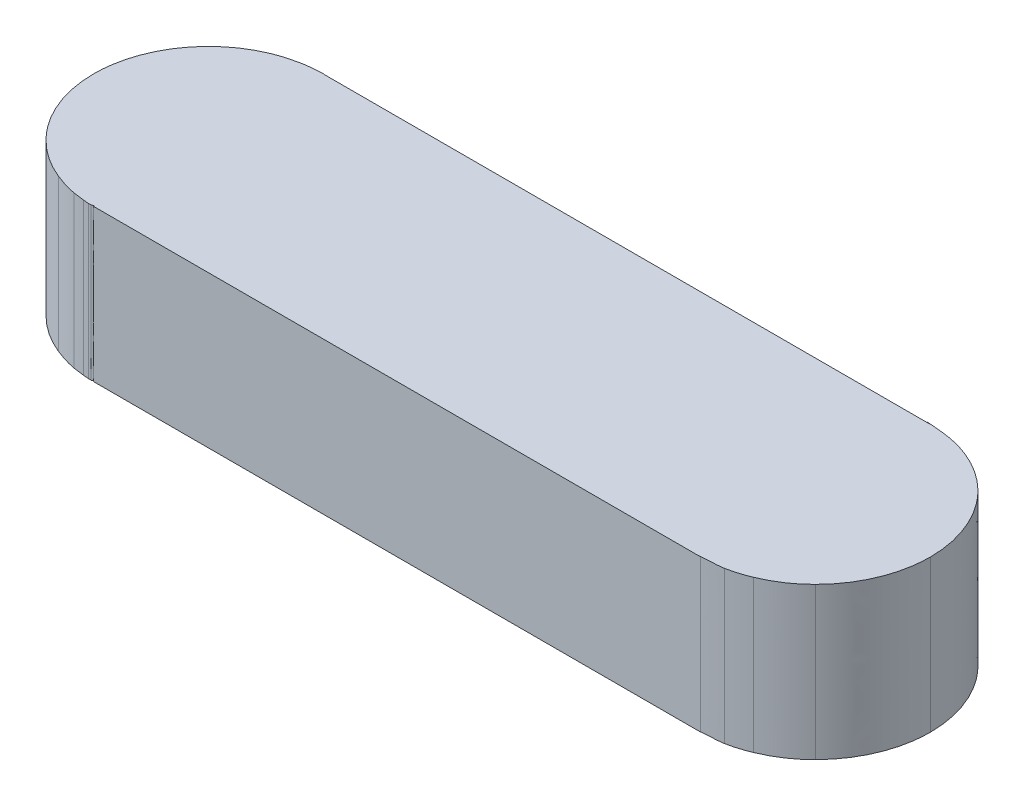
from build123d import *

# Parameters (mm, degrees)
BOSS_EXTRUDE1_DEPTH = 6.35


with BuildPart() as part:
    # Sketch1 → Boss-Extrude1 (new body)
    with BuildSketch(Plane(origin=(0, 0, 0), x_dir=(1, 0, 0), z_dir=(0, 1, 0))):
        with BuildLine():
            Line((5.0230024, 0.2204974), (30.4202338, 0.2204974))
            add(Edge.make_bspline(
                [(30.4202338, 0.2204974), (29.8139104, 0.2204974), (31.033466, 0.245491), (31.3297316, 0.3029966)],
                knots=[0, 0, 0, 0, 1, 1, 1, 1], degree=3))
            add(Edge.make_bspline(
                [(31.3297316, 0.3029966), (31.6535816, 0.364998), (31.9636394, 0.4614926), (32.259905, 0.5854954)],
                knots=[0, 0, 0, 0, 1, 1, 1, 1], degree=3))
            add(Edge.make_bspline(
                [(32.259905, 0.5854954), (32.8593704, 0.833501), (33.3623412, 1.1642344), (33.8171028, 1.6258794)],
                knots=[0, 0, 0, 0, 1, 1, 1, 1], degree=3))
            add(Edge.make_bspline(
                [(33.8171028, 1.6258794), (34.7197172, 2.5216358), (35.2295968, 3.7481002), (35.2295968, 5.0227484)],
                knots=[0, 0, 0, 0, 1, 1, 1, 1], degree=3))
            add(Edge.make_bspline(
                [(35.2295968, 5.0227484), (35.2295968, 6.2974474), (34.7197172, 7.5169776), (33.8239862, 8.4196428)],
                knots=[0, 0, 0, 0, 1, 1, 1, 1], degree=3))
            add(Edge.make_bspline(
                [(33.8239862, 8.4196428), (33.3623412, 8.874633), (32.8593704, 9.2119958), (32.259905, 9.4600522)],
                knots=[0, 0, 0, 0, 1, 1, 1, 1], degree=3))
            add(Edge.make_bspline(
                [(32.259905, 9.4600522), (31.9636648, 9.5840296), (31.6535816, 9.6735392), (31.3297316, 9.7355406)],
                knots=[0, 0, 0, 0, 1, 1, 1, 1], degree=3))
            add(Edge.make_bspline(
                [(31.3297316, 9.7355406), (31.0334406, 9.797542), (29.8207938, 9.8940366), (30.4202338, 9.8250502)],
                knots=[0, 0, 0, 0, 1, 1, 1, 1], degree=3))
            Line((30.4202338, 9.8250502), (5.0230024, 9.8240342))
            add(Edge.make_bspline(
                [(5.0230024, 9.8240342), (5.091938, 9.8440494), (4.9471326, 9.8240342), (4.912741, 9.8240342)],
                knots=[0, 0, 0, 0, 1, 1, 1, 1], degree=3))
            add(Edge.make_bspline(
                [(4.912741, 9.8240342), (4.8782478, 9.8240342), (4.8368966, 9.8190304), (4.802505, 9.8190304)],
                knots=[0, 0, 0, 0, 1, 1, 1, 1], degree=3))
            add(Edge.make_bspline(
                [(4.802505, 9.8190304), (4.7266352, 9.8190304), (4.650994, 9.814052), (4.5750988, 9.8040444)],
                knots=[0, 0, 0, 0, 1, 1, 1, 1], degree=3))
            add(Edge.make_bspline(
                [(4.5750988, 9.8040444), (4.4167044, 9.789033), (4.265041, 9.7690432), (4.1134538, 9.7350326)],
                knots=[0, 0, 0, 0, 1, 1, 1, 1], degree=3))
            add(Edge.make_bspline(
                [(4.1134538, 9.7350326), (3.7964872, 9.6730312), (3.4864548, 9.583547), (3.1832804, 9.4595442)],
                knots=[0, 0, 0, 0, 1, 1, 1, 1], degree=3))
            add(Edge.make_bspline(
                [(3.1832804, 9.4595442), (2.5838404, 9.2115386), (2.0877276, 8.8738964), (1.6260826, 8.4191348)],
                knots=[0, 0, 0, 0, 1, 1, 1, 1], degree=3))
            add(Edge.make_bspline(
                [(1.6260826, 8.4191348), (0.7234682, 7.5165458), (0.2204974, 6.2969394), (0.2204974, 5.0222404)],
                knots=[0, 0, 0, 0, 1, 1, 1, 1], degree=3))
            add(Edge.make_bspline(
                [(0.2204974, 5.0222404), (0.2204974, 3.7475922), (0.7234682, 2.5280366), (1.6260826, 1.6253968)],
                knots=[0, 0, 0, 0, 1, 1, 1, 1], degree=3))
            add(Edge.make_bspline(
                [(1.6260826, 1.6253968), (2.087753, 1.1638788), (2.5838404, 0.8330438), (3.1832804, 0.5849874)],
                knots=[0, 0, 0, 0, 1, 1, 1, 1], degree=3))
            add(Edge.make_bspline(
                [(3.1832804, 0.5849874), (3.4864802, 0.4609846), (3.7965126, 0.36449), (4.1134538, 0.3024886)],
                knots=[0, 0, 0, 0, 1, 1, 1, 1], degree=3))
            add(Edge.make_bspline(
                [(4.1134538, 0.3024886), (4.2649394, 0.277495), (4.4166028, 0.2525014), (4.5750988, 0.2404872)],
                knots=[0, 0, 0, 0, 1, 1, 1, 1], degree=3))
            add(Edge.make_bspline(
                [(4.5750988, 0.2404872), (4.6509432, 0.2354834), (4.7265844, 0.2255012), (4.802505, 0.2204974)],
                knots=[0, 0, 0, 0, 1, 1, 1, 1], degree=3))
            add(Edge.make_bspline(
                [(4.802505, 0.2204974), (4.8369982, 0.2204974), (4.8783494, 0.2204974), (4.912741, 0.2204974)],
                knots=[0, 0, 0, 0, 1, 1, 1, 1], degree=3))
            add(Edge.make_bspline(
                [(4.912741, 0.2204974), (4.9472342, 0.2204974), (5.0230024, 0.2894838), (5.0230024, 0.2204974)],
                knots=[0, 0, 0, 0, 1, 1, 1, 1], degree=3))
        make_face()
    extrude(amount=BOSS_EXTRUDE1_DEPTH)


solid = part.part
